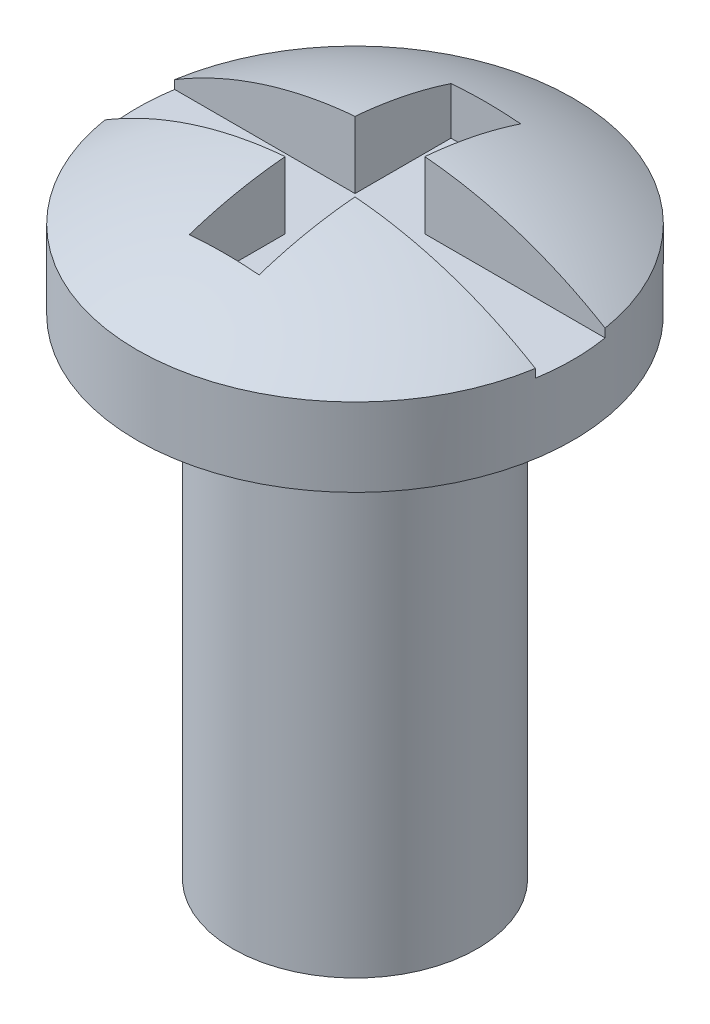
from build123d import *

# Parameters (mm, degrees)
SKETCH_1_R          = 1.75
EXTRUDE_1_DEPTH     = 7
SKETCH_2_R          = 3.125
EXTRUDE_2_DEPTH     = 2
SKETCH_3_W          = 7.004697232
SKETCH_3_H          = 1
CUT_EXTRUDE_1_DEPTH = 1
SKETCH_4_W          = 1
SKETCH_4_H          = 3.75
CUT_EXTRUDE_2_DEPTH = 1


with BuildPart() as part:
    # 草图1 → 拉伸1 (new body)
    with BuildSketch(Plane(origin=(0, 0, 0), x_dir=(1, 0, 0), z_dir=(0, 1, 0))):
        with Locations(Location((0, 0, 0), (0, 0, 270))):
            Circle(SKETCH_1_R)
    extrude(amount=EXTRUDE_1_DEPTH)

    # 草图2 → 拉伸2 (add)
    with BuildSketch(Plane(origin=(0, 7, 0), x_dir=(-1, 0, 0), z_dir=(0, 1, 0))):
        with Locations(Location((0, 0, 0), (0, 0, 90))):
            Circle(SKETCH_2_R)
    extrude(amount=EXTRUDE_2_DEPTH)

    # 草图3 → 切除-拉伸1 (cut)
    with BuildSketch(Plane(origin=(0, 9, 0), x_dir=(-1, 0, 0), z_dir=(0, 1, 0))):
        Rectangle(SKETCH_3_W, SKETCH_3_H)
    extrude(amount=-CUT_EXTRUDE_1_DEPTH, mode=Mode.SUBTRACT)

    # 草图4 → 切除-拉伸2 (cut)
    with BuildSketch(Plane(origin=(0, 9, 0), x_dir=(-1, 0, 0), z_dir=(0, 1, 0))):
        Rectangle(SKETCH_4_W, SKETCH_4_H)
    extrude(amount=-CUT_EXTRUDE_2_DEPTH, mode=Mode.SUBTRACT)

    # 草图5 → 切除-旋转16 (revolve, cut)
    with BuildSketch(Plane(origin=(0, 0, 0), x_dir=(0, 0, -1), z_dir=(1, 0, 0)), mode=Mode.PRIVATE) as cut_revolve_16_sk:
        with BuildLine():
            Line((0, 10.999822694), (-4.5493707, 10.999822694))
            Line((-4.5493707, 10.999822694), (-4.5493707, 6.911933822))
            ThreePointArc((-4.5493707, 6.911933822), (-2.502838096, 8.453054325), (0, 9))
            Line((0, 9), (0, 10.999822694))
        make_face()
    revolve(cut_revolve_16_sk.sketch.rotate(Axis((0, -2.105917543, 0), (0, 1, 0)), 260.793103779), axis=Axis((0, -2.105917543, 0), (0, 1, 0)), mode=Mode.SUBTRACT)


solid = part.part
